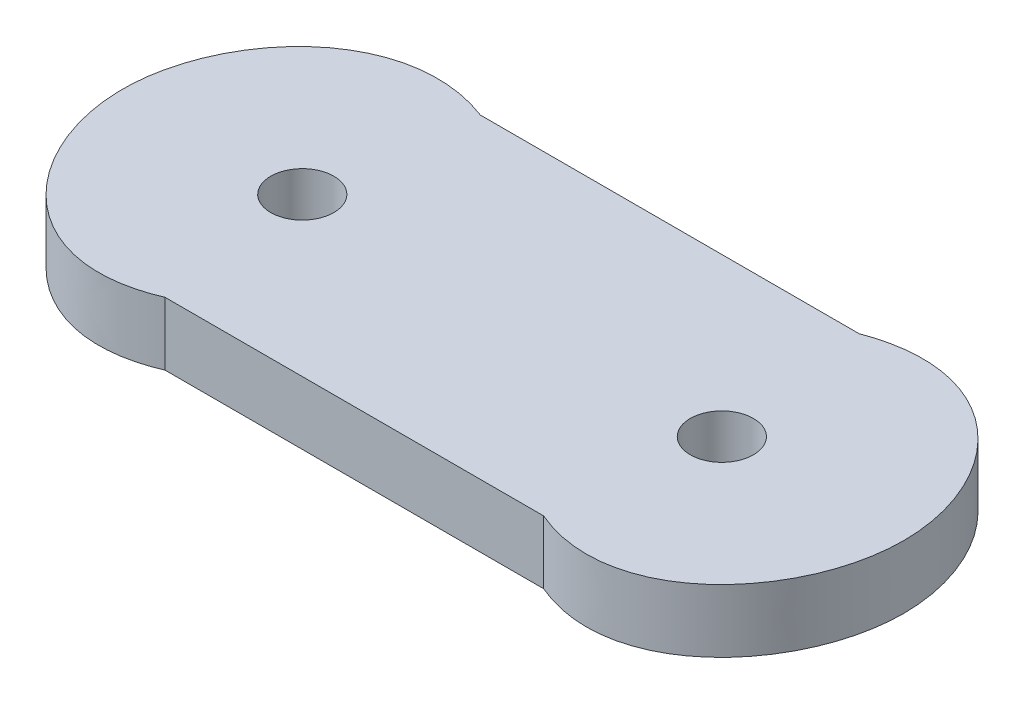
from build123d import *

# Parameters (mm, degrees)
ESQUISSE2_R        = 1.5
BOSS_EXTRU_1_DEPTH = 3


with BuildPart() as part:
    # Esquisse2 → Boss.-Extru.1 (new body)
    with BuildSketch(Plane(origin=(0, 0, 0), x_dir=(1, 0, 0), z_dir=(0, 1, 0))):
        with BuildLine():
            Line((9, 7.5), (-9, 7.5))
            add(Edge.make_bspline(
                [(-9, 7.5), (-14.368679203, 9.540675776), (-22.864046294, 0.062993), (-14.222464977, -9.74400485), (-9, -7.5)],
                knots=[0, 0, 0, 0, 0.498997334, 1, 1, 1, 1], degree=3))
            Line((-9, -7.5), (9, -7.5))
            add(Edge.make_bspline(
                [(9, 7.5), (14.368679203, 9.540675776), (22.864046294, 0.062993), (14.222464977, -9.74400485), (9, -7.5)],
                knots=[0, 0, 0, 0, 0.498997334, 1, 1, 1, 1], degree=3))
        make_face()
        with Locations(Location((-9.973759583, 0, 0), (0, 0, 270))):
            Circle(ESQUISSE2_R, mode=Mode.SUBTRACT)
        with Locations(Location((9.973759583, 0, 0), (0, 0, 90))):
            Circle(ESQUISSE2_R, mode=Mode.SUBTRACT)
    extrude(amount=BOSS_EXTRU_1_DEPTH)


solid = part.part
